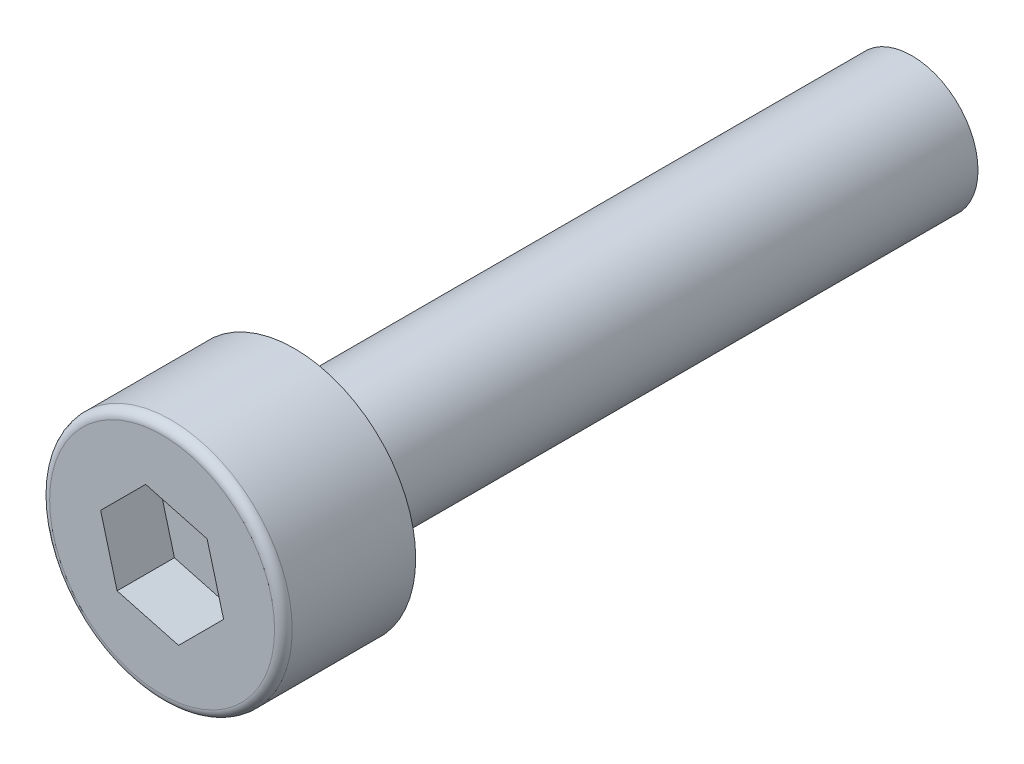
from build123d import *

# Parameters (mm, degrees)
SKETCH_1_R          = 2.75
EXTRUDE_1_DEPTH     = 3
CUT_EXTRUDE_1_DEPTH = 1.3
SKETCH_3_R          = 1.5
EXTRUDE_2_DEPTH     = 14
FILLET_1_R          = 0.2


with BuildPart() as part:
    # 草图1 → 凸台-拉伸1 (new body)
    with BuildSketch(Plane.XY):
        Circle(SKETCH_1_R)
    extrude(amount=EXTRUDE_1_DEPTH)

    # 草图2 → 切除-拉伸1 (cut)
    with BuildSketch(Plane.XY.offset(3)):
        Polygon((-1.020620726, -1.020620726), (0.373573113, -1.39419384), (1.39419384, -0.373573113), (1.020620726, 1.020620726), (-0.373573113, 1.39419384), (-1.39419384, 0.373573113), align=None)
    extrude(amount=-CUT_EXTRUDE_1_DEPTH, mode=Mode.SUBTRACT)

    # 草图3 → 凸台-拉伸2 (add)
    with BuildSketch(Plane(origin=(0, 0, 0), x_dir=(-1, 0, 0), z_dir=(0, 0, -1))):
        with Locations(Location((0, 0, 0), (0, 0, 180))):
            Circle(SKETCH_3_R)
    extrude(amount=EXTRUDE_2_DEPTH)

    # 圆角1
    fillet_1_edges = [part.edges().sort_by_distance(p)[0] for p in [
        (-2.75, 0, 3),
    ]]
    fillet(fillet_1_edges, radius=FILLET_1_R)


solid = part.part
